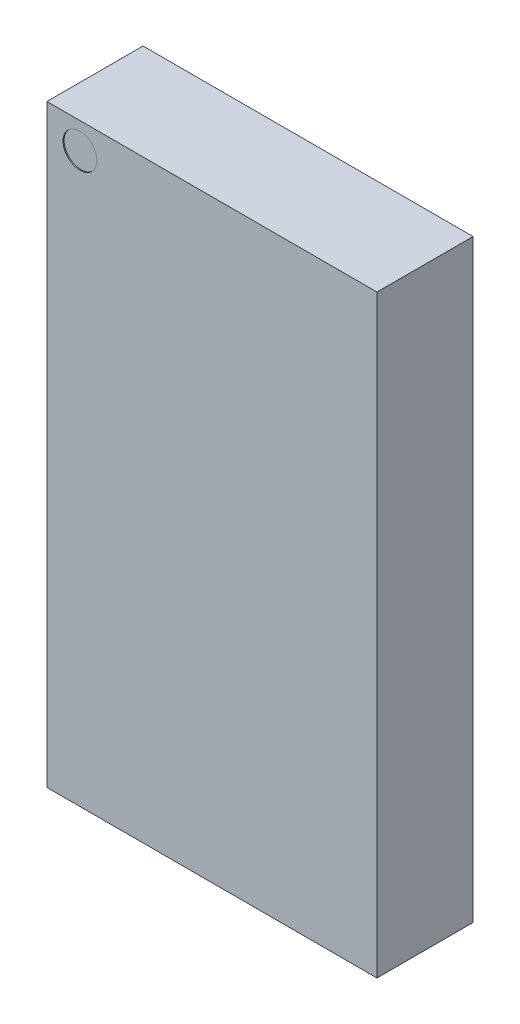
from build123d import *

# Parameters (mm, degrees)
BOSS_EXTRUDE1_START  = 0.4
SKETCH1_W            = 6.25
SKETCH1_H            = 11.25
BOSS_EXTRUDE1_DEPTH  = 1.82
LPATTERN1_COUNT      = 7
LPATTERN1_PITCH      = 0.8
LPATTERN1_COUNT_DIR2 = 4
LPATTERN1_PITCH_DIR2 = 0.8
LPATTERN2_COUNT      = 7
LPATTERN2_PITCH      = 0.8
LPATTERN2_COUNT_DIR2 = 4
LPATTERN2_PITCH_DIR2 = 0.8
BOSS_EXTRUDE2_DEPTH  = 0.02
SKETCH5_R            = 0.320150815
CUT_EXTRUDE1_DEPTH   = 0.02


with BuildPart() as part:
    # Sketch1 → Boss-Extrude1 (new body)
    with BuildSketch(Plane.XY.offset(BOSS_EXTRUDE1_START)):
        Rectangle(SKETCH1_W, SKETCH1_H)
    extrude(amount=BOSS_EXTRUDE1_DEPTH)

    # Sketch3 → Revolve1 (revolve)
    with BuildSketch(Plane(origin=(0, 0, 0), x_dir=(1, 0, 0), z_dir=(0, 1, 0))):
        with BuildLine():
            Line((-6.3108e-05, -0.419999995), (0, 0))
            ThreePointArc((0, 0), (0.209968444, -0.210031552), (-6.3108e-05, -0.419999995))
        make_face()
    revolve1 = revolve(axis=Axis((-6.3108e-05, 0, 0.419999995), (0.00015025723872539313, 0, -0.9999999887113811)))

    # LPattern1: Revolve1 7 × 4
    with Locations(*[(j * LPATTERN1_PITCH_DIR2, i * LPATTERN1_PITCH, 0) for i in range(LPATTERN1_COUNT) for j in range(LPATTERN1_COUNT_DIR2) if (i, j) != (0, 0)]):
        add(revolve1)

    # LPattern2: Revolve1 7 × 4, 6 skipped
    with Locations(*[(-j * LPATTERN2_PITCH_DIR2, i * LPATTERN2_PITCH, 0) for i in range(LPATTERN2_COUNT) for j in range(LPATTERN2_COUNT_DIR2) if (i, j) not in ((0, 0), (1, 0), (2, 0), (3, 0), (4, 0), (5, 0), (6, 0))]):
        add(revolve1)

    # Mirror1: Revolve1 across plane
    add(revolve1.mirror(Plane.ZX))

    # Mirror1 copy 1 sketch → Mirror1 copy 1 (revolve)
    with BuildSketch(Plane(origin=(0.8, 0, 0), x_dir=(1, 0, 0), z_dir=(0, -1, 0))):
        with BuildLine():
            Line((-6.3108e-05, 0.419999995), (0, 0))
            ThreePointArc((0, 0), (0.209968444, 0.210031552), (-6.3108e-05, 0.419999995))
        make_face()
    revolve(axis=Axis((0.799936892, 0, 0.419999995), (-0.00015025723872539313, 0, 0.9999999887113811)))

    # Mirror1 copy 2 sketch → Mirror1 copy 2 (revolve)
    with BuildSketch(Plane(origin=(1.6, 0, 0), x_dir=(1, 0, 0), z_dir=(0, -1, 0))):
        with BuildLine():
            Line((-6.3108e-05, 0.419999995), (0, 0))
            ThreePointArc((0, 0), (0.209968444, 0.210031552), (-6.3108e-05, 0.419999995))
        make_face()
    revolve(axis=Axis((1.599936892, 0, 0.419999995), (-0.00015025723872539313, 0, 0.9999999887113811)))

    # Mirror1 copy 3 sketch → Mirror1 copy 3 (revolve)
    with BuildSketch(Plane(origin=(2.4, 0, 0), x_dir=(1, 0, 0), z_dir=(0, -1, 0))):
        with BuildLine():
            Line((-6.3108e-05, 0.419999995), (0, 0))
            ThreePointArc((0, 0), (0.209968444, 0.210031552), (-6.3108e-05, 0.419999995))
        make_face()
    revolve(axis=Axis((2.399936892, 0, 0.419999995), (-0.00015025723872539313, 0, 0.9999999887113811)))

    # Mirror1 copy 4 sketch → Mirror1 copy 4 (revolve)
    with BuildSketch(Plane.XZ.offset(0.8)):
        with BuildLine():
            Line((-6.3108e-05, 0.419999995), (0, 0))
            ThreePointArc((0, 0), (0.209968444, 0.210031552), (-6.3108e-05, 0.419999995))
        make_face()
    revolve(axis=Axis((-6.3108e-05, -0.8, 0.419999995), (-0.00015025723872539313, 0, 0.9999999887113811)))

    # Mirror1 copy 5 sketch → Mirror1 copy 5 (revolve)
    with BuildSketch(Plane(origin=(0.8, -0.8, 0), x_dir=(1, 0, 0), z_dir=(0, -1, 0))):
        with BuildLine():
            Line((-6.3108e-05, 0.419999995), (0, 0))
            ThreePointArc((0, 0), (0.209968444, 0.210031552), (-6.3108e-05, 0.419999995))
        make_face()
    revolve(axis=Axis((0.799936892, -0.8, 0.419999995), (-0.00015025723872539313, 0, 0.9999999887113811)))

    # Mirror1 copy 6 sketch → Mirror1 copy 6 (revolve)
    with BuildSketch(Plane(origin=(1.6, -0.8, 0), x_dir=(1, 0, 0), z_dir=(0, -1, 0))):
        with BuildLine():
            Line((-6.3108e-05, 0.419999995), (0, 0))
            ThreePointArc((0, 0), (0.209968444, 0.210031552), (-6.3108e-05, 0.419999995))
        make_face()
    revolve(axis=Axis((1.599936892, -0.8, 0.419999995), (-0.00015025723872539313, 0, 0.9999999887113811)))

    # Mirror1 copy 7 sketch → Mirror1 copy 7 (revolve)
    with BuildSketch(Plane(origin=(2.4, -0.8, 0), x_dir=(1, 0, 0), z_dir=(0, -1, 0))):
        with BuildLine():
            Line((-6.3108e-05, 0.419999995), (0, 0))
            ThreePointArc((0, 0), (0.209968444, 0.210031552), (-6.3108e-05, 0.419999995))
        make_face()
    revolve(axis=Axis((2.399936892, -0.8, 0.419999995), (-0.00015025723872539313, 0, 0.9999999887113811)))

    # Mirror1 copy 8 sketch → Mirror1 copy 8 (revolve)
    with BuildSketch(Plane.XZ.offset(1.6)):
        with BuildLine():
            Line((-6.3108e-05, 0.419999995), (0, 0))
            ThreePointArc((0, 0), (0.209968444, 0.210031552), (-6.3108e-05, 0.419999995))
        make_face()
    revolve(axis=Axis((-6.3108e-05, -1.6, 0.419999995), (-0.00015025723872539313, 0, 0.9999999887113811)))

    # Mirror1 copy 9 sketch → Mirror1 copy 9 (revolve)
    with BuildSketch(Plane(origin=(0.8, -1.6, 0), x_dir=(1, 0, 0), z_dir=(0, -1, 0))):
        with BuildLine():
            Line((-6.3108e-05, 0.419999995), (0, 0))
            ThreePointArc((0, 0), (0.209968444, 0.210031552), (-6.3108e-05, 0.419999995))
        make_face()
    revolve(axis=Axis((0.799936892, -1.6, 0.419999995), (-0.00015025723872539313, 0, 0.9999999887113811)))

    # Mirror1 copy 10 sketch → Mirror1 copy 10 (revolve)
    with BuildSketch(Plane(origin=(1.6, -1.6, 0), x_dir=(1, 0, 0), z_dir=(0, -1, 0))):
        with BuildLine():
            Line((-6.3108e-05, 0.419999995), (0, 0))
            ThreePointArc((0, 0), (0.209968444, 0.210031552), (-6.3108e-05, 0.419999995))
        make_face()
    revolve(axis=Axis((1.599936892, -1.6, 0.419999995), (-0.00015025723872539313, 0, 0.9999999887113811)))

    # Mirror1 copy 11 sketch → Mirror1 copy 11 (revolve)
    with BuildSketch(Plane(origin=(2.4, -1.6, 0), x_dir=(1, 0, 0), z_dir=(0, -1, 0))):
        with BuildLine():
            Line((-6.3108e-05, 0.419999995), (0, 0))
            ThreePointArc((0, 0), (0.209968444, 0.210031552), (-6.3108e-05, 0.419999995))
        make_face()
    revolve(axis=Axis((2.399936892, -1.6, 0.419999995), (-0.00015025723872539313, 0, 0.9999999887113811)))

    # Mirror1 copy 12 sketch → Mirror1 copy 12 (revolve)
    with BuildSketch(Plane.XZ.offset(2.4)):
        with BuildLine():
            Line((-6.3108e-05, 0.419999995), (0, 0))
            ThreePointArc((0, 0), (0.209968444, 0.210031552), (-6.3108e-05, 0.419999995))
        make_face()
    revolve(axis=Axis((-6.3108e-05, -2.4, 0.419999995), (-0.00015025723872539313, 0, 0.9999999887113811)))

    # Mirror1 copy 13 sketch → Mirror1 copy 13 (revolve)
    with BuildSketch(Plane(origin=(0.8, -2.4, 0), x_dir=(1, 0, 0), z_dir=(0, -1, 0))):
        with BuildLine():
            Line((-6.3108e-05, 0.419999995), (0, 0))
            ThreePointArc((0, 0), (0.209968444, 0.210031552), (-6.3108e-05, 0.419999995))
        make_face()
    revolve(axis=Axis((0.799936892, -2.4, 0.419999995), (-0.00015025723872539313, 0, 0.9999999887113811)))

    # Mirror1 copy 14 sketch → Mirror1 copy 14 (revolve)
    with BuildSketch(Plane(origin=(1.6, -2.4, 0), x_dir=(1, 0, 0), z_dir=(0, -1, 0))):
        with BuildLine():
            Line((-6.3108e-05, 0.419999995), (0, 0))
            ThreePointArc((0, 0), (0.209968444, 0.210031552), (-6.3108e-05, 0.419999995))
        make_face()
    revolve(axis=Axis((1.599936892, -2.4, 0.419999995), (-0.00015025723872539313, 0, 0.9999999887113811)))

    # Mirror1 copy 15 sketch → Mirror1 copy 15 (revolve)
    with BuildSketch(Plane(origin=(2.4, -2.4, 0), x_dir=(1, 0, 0), z_dir=(0, -1, 0))):
        with BuildLine():
            Line((-6.3108e-05, 0.419999995), (0, 0))
            ThreePointArc((0, 0), (0.209968444, 0.210031552), (-6.3108e-05, 0.419999995))
        make_face()
    revolve(axis=Axis((2.399936892, -2.4, 0.419999995), (-0.00015025723872539313, 0, 0.9999999887113811)))

    # Mirror1 copy 16 sketch → Mirror1 copy 16 (revolve)
    with BuildSketch(Plane.XZ.offset(3.2)):
        with BuildLine():
            Line((-6.3108e-05, 0.419999995), (0, 0))
            ThreePointArc((0, 0), (0.209968444, 0.210031552), (-6.3108e-05, 0.419999995))
        make_face()
    revolve(axis=Axis((-6.3108e-05, -3.2, 0.419999995), (-0.00015025723872539313, 0, 0.9999999887113811)))

    # Mirror1 copy 17 sketch → Mirror1 copy 17 (revolve)
    with BuildSketch(Plane(origin=(0.8, -3.2, 0), x_dir=(1, 0, 0), z_dir=(0, -1, 0))):
        with BuildLine():
            Line((-6.3108e-05, 0.419999995), (0, 0))
            ThreePointArc((0, 0), (0.209968444, 0.210031552), (-6.3108e-05, 0.419999995))
        make_face()
    revolve(axis=Axis((0.799936892, -3.2, 0.419999995), (-0.00015025723872539313, 0, 0.9999999887113811)))

    # Mirror1 copy 18 sketch → Mirror1 copy 18 (revolve)
    with BuildSketch(Plane(origin=(1.6, -3.2, 0), x_dir=(1, 0, 0), z_dir=(0, -1, 0))):
        with BuildLine():
            Line((-6.3108e-05, 0.419999995), (0, 0))
            ThreePointArc((0, 0), (0.209968444, 0.210031552), (-6.3108e-05, 0.419999995))
        make_face()
    revolve(axis=Axis((1.599936892, -3.2, 0.419999995), (-0.00015025723872539313, 0, 0.9999999887113811)))

    # Mirror1 copy 19 sketch → Mirror1 copy 19 (revolve)
    with BuildSketch(Plane(origin=(2.4, -3.2, 0), x_dir=(1, 0, 0), z_dir=(0, -1, 0))):
        with BuildLine():
            Line((-6.3108e-05, 0.419999995), (0, 0))
            ThreePointArc((0, 0), (0.209968444, 0.210031552), (-6.3108e-05, 0.419999995))
        make_face()
    revolve(axis=Axis((2.399936892, -3.2, 0.419999995), (-0.00015025723872539313, 0, 0.9999999887113811)))

    # Mirror1 copy 20 sketch → Mirror1 copy 20 (revolve)
    with BuildSketch(Plane.XZ.offset(4)):
        with BuildLine():
            Line((-6.3108e-05, 0.419999995), (0, 0))
            ThreePointArc((0, 0), (0.209968444, 0.210031552), (-6.3108e-05, 0.419999995))
        make_face()
    revolve(axis=Axis((-6.3108e-05, -4, 0.419999995), (-0.00015025723872539313, 0, 0.9999999887113811)))

    # Mirror1 copy 21 sketch → Mirror1 copy 21 (revolve)
    with BuildSketch(Plane(origin=(0.8, -4, 0), x_dir=(1, 0, 0), z_dir=(0, -1, 0))):
        with BuildLine():
            Line((-6.3108e-05, 0.419999995), (0, 0))
            ThreePointArc((0, 0), (0.209968444, 0.210031552), (-6.3108e-05, 0.419999995))
        make_face()
    revolve(axis=Axis((0.799936892, -4, 0.419999995), (-0.00015025723872539313, 0, 0.9999999887113811)))

    # Mirror1 copy 22 sketch → Mirror1 copy 22 (revolve)
    with BuildSketch(Plane(origin=(1.6, -4, 0), x_dir=(1, 0, 0), z_dir=(0, -1, 0))):
        with BuildLine():
            Line((-6.3108e-05, 0.419999995), (0, 0))
            ThreePointArc((0, 0), (0.209968444, 0.210031552), (-6.3108e-05, 0.419999995))
        make_face()
    revolve(axis=Axis((1.599936892, -4, 0.419999995), (-0.00015025723872539313, 0, 0.9999999887113811)))

    # Mirror1 copy 23 sketch → Mirror1 copy 23 (revolve)
    with BuildSketch(Plane(origin=(2.4, -4, 0), x_dir=(1, 0, 0), z_dir=(0, -1, 0))):
        with BuildLine():
            Line((-6.3108e-05, 0.419999995), (0, 0))
            ThreePointArc((0, 0), (0.209968444, 0.210031552), (-6.3108e-05, 0.419999995))
        make_face()
    revolve(axis=Axis((2.399936892, -4, 0.419999995), (-0.00015025723872539313, 0, 0.9999999887113811)))

    # Mirror1 copy 24 sketch → Mirror1 copy 24 (revolve)
    with BuildSketch(Plane.XZ.offset(4.8)):
        with BuildLine():
            Line((-6.3108e-05, 0.419999995), (0, 0))
            ThreePointArc((0, 0), (0.209968444, 0.210031552), (-6.3108e-05, 0.419999995))
        make_face()
    revolve(axis=Axis((-6.3108e-05, -4.8, 0.419999995), (-0.00015025723872539313, 0, 0.9999999887113811)))

    # Mirror1 copy 25 sketch → Mirror1 copy 25 (revolve)
    with BuildSketch(Plane(origin=(0.8, -4.8, 0), x_dir=(1, 0, 0), z_dir=(0, -1, 0))):
        with BuildLine():
            Line((-6.3108e-05, 0.419999995), (0, 0))
            ThreePointArc((0, 0), (0.209968444, 0.210031552), (-6.3108e-05, 0.419999995))
        make_face()
    revolve(axis=Axis((0.799936892, -4.8, 0.419999995), (-0.00015025723872539313, 0, 0.9999999887113811)))

    # Mirror1 copy 26 sketch → Mirror1 copy 26 (revolve)
    with BuildSketch(Plane(origin=(1.6, -4.8, 0), x_dir=(1, 0, 0), z_dir=(0, -1, 0))):
        with BuildLine():
            Line((-6.3108e-05, 0.419999995), (0, 0))
            ThreePointArc((0, 0), (0.209968444, 0.210031552), (-6.3108e-05, 0.419999995))
        make_face()
    revolve(axis=Axis((1.599936892, -4.8, 0.419999995), (-0.00015025723872539313, 0, 0.9999999887113811)))

    # Mirror1 copy 27 sketch → Mirror1 copy 27 (revolve)
    with BuildSketch(Plane(origin=(2.4, -4.8, 0), x_dir=(1, 0, 0), z_dir=(0, -1, 0))):
        with BuildLine():
            Line((-6.3108e-05, 0.419999995), (0, 0))
            ThreePointArc((0, 0), (0.209968444, 0.210031552), (-6.3108e-05, 0.419999995))
        make_face()
    revolve(axis=Axis((2.399936892, -4.8, 0.419999995), (-0.00015025723872539313, 0, 0.9999999887113811)))

    # Mirror1 copy 28 sketch → Mirror1 copy 28 (revolve)
    with BuildSketch(Plane(origin=(-0.8, 0, 0), x_dir=(1, 0, 0), z_dir=(0, -1, 0))):
        with BuildLine():
            Line((-6.3108e-05, 0.419999995), (0, 0))
            ThreePointArc((0, 0), (0.209968444, 0.210031552), (-6.3108e-05, 0.419999995))
        make_face()
    revolve(axis=Axis((-0.800063108, 0, 0.419999995), (-0.00015025723872539313, 0, 0.9999999887113811)))

    # Mirror1 copy 29 sketch → Mirror1 copy 29 (revolve)
    with BuildSketch(Plane(origin=(-1.6, 0, 0), x_dir=(1, 0, 0), z_dir=(0, -1, 0))):
        with BuildLine():
            Line((-6.3108e-05, 0.419999995), (0, 0))
            ThreePointArc((0, 0), (0.209968444, 0.210031552), (-6.3108e-05, 0.419999995))
        make_face()
    revolve(axis=Axis((-1.600063108, 0, 0.419999995), (-0.00015025723872539313, 0, 0.9999999887113811)))

    # Mirror1 copy 30 sketch → Mirror1 copy 30 (revolve)
    with BuildSketch(Plane(origin=(-2.4, 0, 0), x_dir=(1, 0, 0), z_dir=(0, -1, 0))):
        with BuildLine():
            Line((-6.3108e-05, 0.419999995), (0, 0))
            ThreePointArc((0, 0), (0.209968444, 0.210031552), (-6.3108e-05, 0.419999995))
        make_face()
    revolve(axis=Axis((-2.400063108, 0, 0.419999995), (-0.00015025723872539313, 0, 0.9999999887113811)))

    # Mirror1 copy 31 sketch → Mirror1 copy 31 (revolve)
    with BuildSketch(Plane(origin=(-0.8, -0.8, 0), x_dir=(1, 0, 0), z_dir=(0, -1, 0))):
        with BuildLine():
            Line((-6.3108e-05, 0.419999995), (0, 0))
            ThreePointArc((0, 0), (0.209968444, 0.210031552), (-6.3108e-05, 0.419999995))
        make_face()
    revolve(axis=Axis((-0.800063108, -0.8, 0.419999995), (-0.00015025723872539313, 0, 0.9999999887113811)))

    # Mirror1 copy 32 sketch → Mirror1 copy 32 (revolve)
    with BuildSketch(Plane(origin=(-1.6, -0.8, 0), x_dir=(1, 0, 0), z_dir=(0, -1, 0))):
        with BuildLine():
            Line((-6.3108e-05, 0.419999995), (0, 0))
            ThreePointArc((0, 0), (0.209968444, 0.210031552), (-6.3108e-05, 0.419999995))
        make_face()
    revolve(axis=Axis((-1.600063108, -0.8, 0.419999995), (-0.00015025723872539313, 0, 0.9999999887113811)))

    # Mirror1 copy 33 sketch → Mirror1 copy 33 (revolve)
    with BuildSketch(Plane(origin=(-2.4, -0.8, 0), x_dir=(1, 0, 0), z_dir=(0, -1, 0))):
        with BuildLine():
            Line((-6.3108e-05, 0.419999995), (0, 0))
            ThreePointArc((0, 0), (0.209968444, 0.210031552), (-6.3108e-05, 0.419999995))
        make_face()
    revolve(axis=Axis((-2.400063108, -0.8, 0.419999995), (-0.00015025723872539313, 0, 0.9999999887113811)))

    # Mirror1 copy 34 sketch → Mirror1 copy 34 (revolve)
    with BuildSketch(Plane(origin=(-0.8, -1.6, 0), x_dir=(1, 0, 0), z_dir=(0, -1, 0))):
        with BuildLine():
            Line((-6.3108e-05, 0.419999995), (0, 0))
            ThreePointArc((0, 0), (0.209968444, 0.210031552), (-6.3108e-05, 0.419999995))
        make_face()
    revolve(axis=Axis((-0.800063108, -1.6, 0.419999995), (-0.00015025723872539313, 0, 0.9999999887113811)))

    # Mirror1 copy 35 sketch → Mirror1 copy 35 (revolve)
    with BuildSketch(Plane(origin=(-1.6, -1.6, 0), x_dir=(1, 0, 0), z_dir=(0, -1, 0))):
        with BuildLine():
            Line((-6.3108e-05, 0.419999995), (0, 0))
            ThreePointArc((0, 0), (0.209968444, 0.210031552), (-6.3108e-05, 0.419999995))
        make_face()
    revolve(axis=Axis((-1.600063108, -1.6, 0.419999995), (-0.00015025723872539313, 0, 0.9999999887113811)))

    # Mirror1 copy 36 sketch → Mirror1 copy 36 (revolve)
    with BuildSketch(Plane(origin=(-2.4, -1.6, 0), x_dir=(1, 0, 0), z_dir=(0, -1, 0))):
        with BuildLine():
            Line((-6.3108e-05, 0.419999995), (0, 0))
            ThreePointArc((0, 0), (0.209968444, 0.210031552), (-6.3108e-05, 0.419999995))
        make_face()
    revolve(axis=Axis((-2.400063108, -1.6, 0.419999995), (-0.00015025723872539313, 0, 0.9999999887113811)))

    # Mirror1 copy 37 sketch → Mirror1 copy 37 (revolve)
    with BuildSketch(Plane(origin=(-0.8, -2.4, 0), x_dir=(1, 0, 0), z_dir=(0, -1, 0))):
        with BuildLine():
            Line((-6.3108e-05, 0.419999995), (0, 0))
            ThreePointArc((0, 0), (0.209968444, 0.210031552), (-6.3108e-05, 0.419999995))
        make_face()
    revolve(axis=Axis((-0.800063108, -2.4, 0.419999995), (-0.00015025723872539313, 0, 0.9999999887113811)))

    # Mirror1 copy 38 sketch → Mirror1 copy 38 (revolve)
    with BuildSketch(Plane(origin=(-1.6, -2.4, 0), x_dir=(1, 0, 0), z_dir=(0, -1, 0))):
        with BuildLine():
            Line((-6.3108e-05, 0.419999995), (0, 0))
            ThreePointArc((0, 0), (0.209968444, 0.210031552), (-6.3108e-05, 0.419999995))
        make_face()
    revolve(axis=Axis((-1.600063108, -2.4, 0.419999995), (-0.00015025723872539313, 0, 0.9999999887113811)))

    # Mirror1 copy 39 sketch → Mirror1 copy 39 (revolve)
    with BuildSketch(Plane(origin=(-2.4, -2.4, 0), x_dir=(1, 0, 0), z_dir=(0, -1, 0))):
        with BuildLine():
            Line((-6.3108e-05, 0.419999995), (0, 0))
            ThreePointArc((0, 0), (0.209968444, 0.210031552), (-6.3108e-05, 0.419999995))
        make_face()
    revolve(axis=Axis((-2.400063108, -2.4, 0.419999995), (-0.00015025723872539313, 0, 0.9999999887113811)))

    # Mirror1 copy 40 sketch → Mirror1 copy 40 (revolve)
    with BuildSketch(Plane(origin=(-0.8, -3.2, 0), x_dir=(1, 0, 0), z_dir=(0, -1, 0))):
        with BuildLine():
            Line((-6.3108e-05, 0.419999995), (0, 0))
            ThreePointArc((0, 0), (0.209968444, 0.210031552), (-6.3108e-05, 0.419999995))
        make_face()
    revolve(axis=Axis((-0.800063108, -3.2, 0.419999995), (-0.00015025723872539313, 0, 0.9999999887113811)))

    # Mirror1 copy 41 sketch → Mirror1 copy 41 (revolve)
    with BuildSketch(Plane(origin=(-1.6, -3.2, 0), x_dir=(1, 0, 0), z_dir=(0, -1, 0))):
        with BuildLine():
            Line((-6.3108e-05, 0.419999995), (0, 0))
            ThreePointArc((0, 0), (0.209968444, 0.210031552), (-6.3108e-05, 0.419999995))
        make_face()
    revolve(axis=Axis((-1.600063108, -3.2, 0.419999995), (-0.00015025723872539313, 0, 0.9999999887113811)))

    # Mirror1 copy 42 sketch → Mirror1 copy 42 (revolve)
    with BuildSketch(Plane(origin=(-2.4, -3.2, 0), x_dir=(1, 0, 0), z_dir=(0, -1, 0))):
        with BuildLine():
            Line((-6.3108e-05, 0.419999995), (0, 0))
            ThreePointArc((0, 0), (0.209968444, 0.210031552), (-6.3108e-05, 0.419999995))
        make_face()
    revolve(axis=Axis((-2.400063108, -3.2, 0.419999995), (-0.00015025723872539313, 0, 0.9999999887113811)))

    # Mirror1 copy 43 sketch → Mirror1 copy 43 (revolve)
    with BuildSketch(Plane(origin=(-0.8, -4, 0), x_dir=(1, 0, 0), z_dir=(0, -1, 0))):
        with BuildLine():
            Line((-6.3108e-05, 0.419999995), (0, 0))
            ThreePointArc((0, 0), (0.209968444, 0.210031552), (-6.3108e-05, 0.419999995))
        make_face()
    revolve(axis=Axis((-0.800063108, -4, 0.419999995), (-0.00015025723872539313, 0, 0.9999999887113811)))

    # Mirror1 copy 44 sketch → Mirror1 copy 44 (revolve)
    with BuildSketch(Plane(origin=(-1.6, -4, 0), x_dir=(1, 0, 0), z_dir=(0, -1, 0))):
        with BuildLine():
            Line((-6.3108e-05, 0.419999995), (0, 0))
            ThreePointArc((0, 0), (0.209968444, 0.210031552), (-6.3108e-05, 0.419999995))
        make_face()
    revolve(axis=Axis((-1.600063108, -4, 0.419999995), (-0.00015025723872539313, 0, 0.9999999887113811)))

    # Mirror1 copy 45 sketch → Mirror1 copy 45 (revolve)
    with BuildSketch(Plane(origin=(-2.4, -4, 0), x_dir=(1, 0, 0), z_dir=(0, -1, 0))):
        with BuildLine():
            Line((-6.3108e-05, 0.419999995), (0, 0))
            ThreePointArc((0, 0), (0.209968444, 0.210031552), (-6.3108e-05, 0.419999995))
        make_face()
    revolve(axis=Axis((-2.400063108, -4, 0.419999995), (-0.00015025723872539313, 0, 0.9999999887113811)))

    # Mirror1 copy 46 sketch → Mirror1 copy 46 (revolve)
    with BuildSketch(Plane(origin=(-0.8, -4.8, 0), x_dir=(1, 0, 0), z_dir=(0, -1, 0))):
        with BuildLine():
            Line((-6.3108e-05, 0.419999995), (0, 0))
            ThreePointArc((0, 0), (0.209968444, 0.210031552), (-6.3108e-05, 0.419999995))
        make_face()
    revolve(axis=Axis((-0.800063108, -4.8, 0.419999995), (-0.00015025723872539313, 0, 0.9999999887113811)))

    # Mirror1 copy 47 sketch → Mirror1 copy 47 (revolve)
    with BuildSketch(Plane(origin=(-1.6, -4.8, 0), x_dir=(1, 0, 0), z_dir=(0, -1, 0))):
        with BuildLine():
            Line((-6.3108e-05, 0.419999995), (0, 0))
            ThreePointArc((0, 0), (0.209968444, 0.210031552), (-6.3108e-05, 0.419999995))
        make_face()
    revolve(axis=Axis((-1.600063108, -4.8, 0.419999995), (-0.00015025723872539313, 0, 0.9999999887113811)))

    # Mirror1 copy 48 sketch → Mirror1 copy 48 (revolve)
    with BuildSketch(Plane(origin=(-2.4, -4.8, 0), x_dir=(1, 0, 0), z_dir=(0, -1, 0))):
        with BuildLine():
            Line((-6.3108e-05, 0.419999995), (0, 0))
            ThreePointArc((0, 0), (0.209968444, 0.210031552), (-6.3108e-05, 0.419999995))
        make_face()
    revolve(axis=Axis((-2.400063108, -4.8, 0.419999995), (-0.00015025723872539313, 0, 0.9999999887113811)))

    # Sketch4 → Boss-Extrude2 (add)
    with BuildSketch(Plane(origin=(0, 0, 0.4), x_dir=(-1, 0, 0), z_dir=(0, 0, -1))):
        Polygon((2.765466942, 5.548579618), (3.061732998, 5.548579618), (3.061732998, 5.252313562), align=None)
    extrude(amount=BOSS_EXTRUDE2_DEPTH)

    # Sketch5 → Cut-Extrude1 (cut)
    with BuildSketch(Plane.XY.offset(2.22)):
        with Locations((-2.499761097, 5.129825285)):
            Circle(SKETCH5_R)
    extrude(amount=-CUT_EXTRUDE1_DEPTH, mode=Mode.SUBTRACT)


solid = part.part
